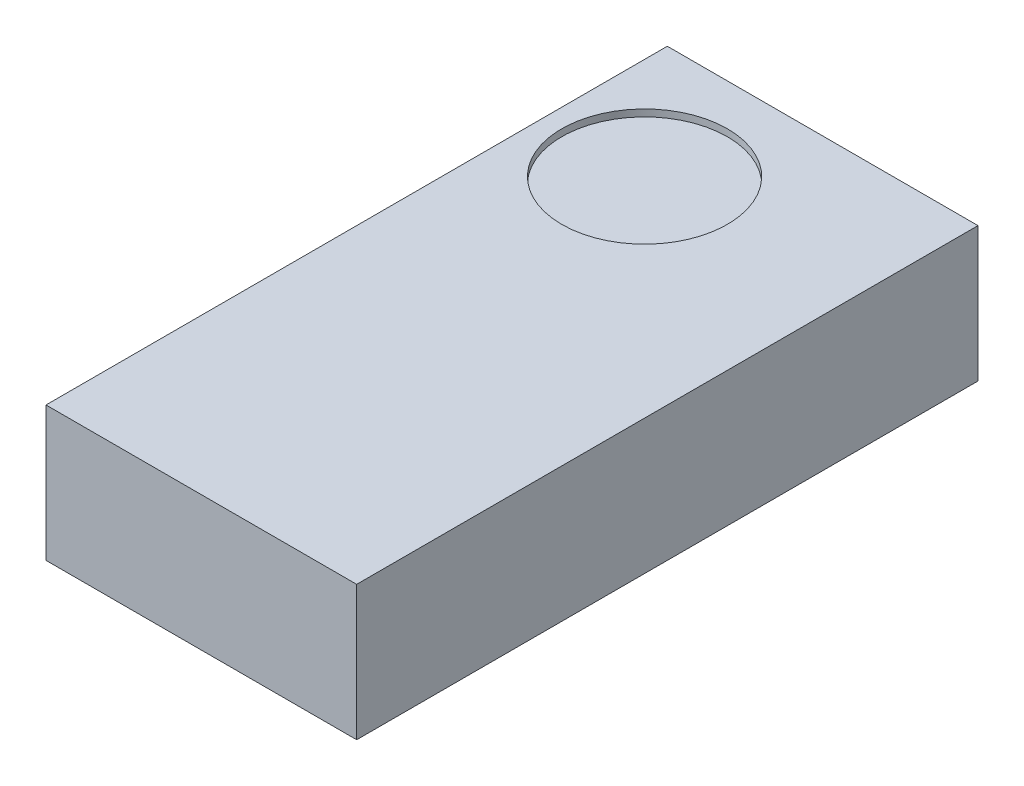
from build123d import *

# Parameters (mm, degrees)
SKETCH1_W           = 114.3
SKETCH1_H           = 228.6
BOSS_EXTRUDE1_DEPTH = 49.53
SKETCH2_R           = 30.48
CUT_EXTRUDE1_DEPTH  = 2.54


with BuildPart() as part:
    # Sketch1 → Boss-Extrude1 (new body)
    with BuildSketch(Plane(origin=(0, 0, 0), x_dir=(1, 0, 0), z_dir=(0, 1, 0))):
        Rectangle(SKETCH1_W, SKETCH1_H)
    extrude(amount=BOSS_EXTRUDE1_DEPTH)

    # Sketch2 → Cut-Extrude1 (cut)
    with BuildSketch(Plane(origin=(0, 49.53, 0), x_dir=(1, 0, 0), z_dir=(0, 1, 0))):
        with Locations(Location((-19.812, 68.58, 0), (0, 0, 270))):
            Circle(SKETCH2_R)
    extrude(amount=-CUT_EXTRUDE1_DEPTH, mode=Mode.SUBTRACT)


solid = part.part
